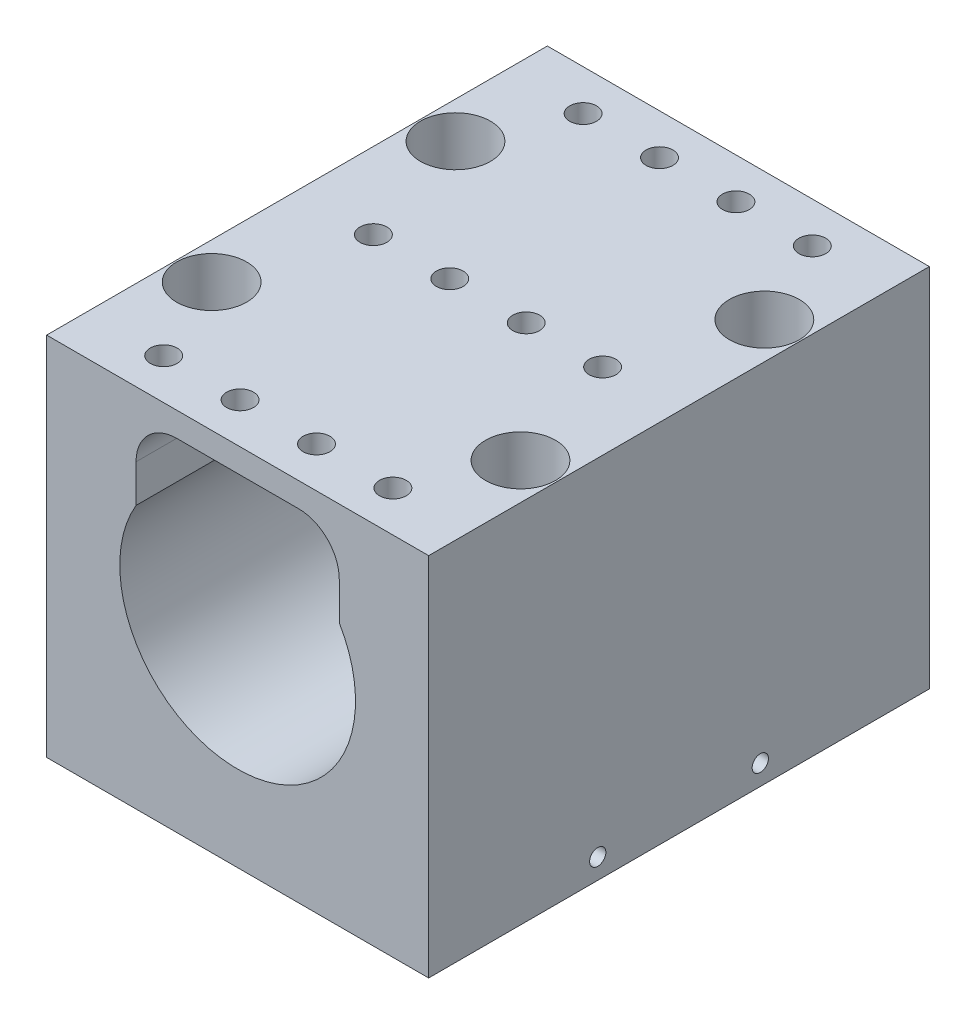
from build123d import *

# Parameters (mm, degrees)
SKETCH_1_W                       = 47
SKETCH_1_H                       = 45
EXTRUDE_1_DEPTH                  = 61.6
SKETCH_2_R                       = 14.5
CUT_EXTRUDE_1_DEPTH              = 100
SKETCH_6_R                       = 2.1
CUT_EXTRUDE_5_DEPTH              = 15
SKETCH_7_W                       = 25
SKETCH_7_H                       = 9.651530772
CUT_EXTRUDE_6_DEPTH              = 100
FILLET_1_R                       = 5
SKETCH_10_R                      = 2.75
CUT_EXTRUDE_8_DEPTH              = 100
PATTERN_LINEAR_2_COUNT           = 2
PATTERN_LINEAR_2_PITCH           = 38
PATTERN_LINEAR_2_COUNT_DIR2      = 2
PATTERN_LINEAR_2_PITCH_DIR2      = 30
SKETCH_11_R                      = 4.3
CUT_EXTRUDE_9_DEPTH              = 40
PATTERN_LINEAR_3_COUNT           = 2
PATTERN_LINEAR_3_PITCH           = 38
PATTERN_LINEAR_3_COUNT_DIR2      = 2
PATTERN_LINEAR_3_PITCH_DIR2      = 30
SKETCH_12_R                      = 1.65
CUT_EXTRUDE_10_DEPTH             = 5
PATTERN_LINEAR_4_COUNT           = 4
PATTERN_LINEAR_4_PITCH           = 9.4
PATTERN_LINEAR_5_COUNT           = 2
PATTERN_LINEAR_5_PITCH           = 25.8
PATTERN_LINEAR_5_COPY_1_SKETCH_R = 1.65
PATTERN_LINEAR_5_COPY_1_DEPTH    = 5
PATTERN_LINEAR_5_COPY_2_SKETCH_R = 1.65
PATTERN_LINEAR_5_COPY_2_DEPTH    = 5
PATTERN_LINEAR_5_COPY_3_SKETCH_R = 1.65
PATTERN_LINEAR_5_COPY_3_DEPTH    = 5
PATTERN_LINEAR_6_COUNT           = 2
PATTERN_LINEAR_6_PITCH           = 51.6
PATTERN_LINEAR_6_COPY_1_SKETCH_R = 1.65
PATTERN_LINEAR_6_COPY_1_DEPTH    = 5
PATTERN_LINEAR_6_COPY_2_SKETCH_R = 1.65
PATTERN_LINEAR_6_COPY_2_DEPTH    = 5
PATTERN_LINEAR_6_COPY_3_SKETCH_R = 1.65
PATTERN_LINEAR_6_COPY_3_DEPTH    = 5
SKETCH_13_R                      = 1
CUT_EXTRUDE_11_DEPTH             = 100


with BuildPart() as part:
    # Эскиз1 → Бобышка-Вытянуть1 (new body)
    with BuildSketch(Plane.XY):
        Rectangle(SKETCH_1_W, SKETCH_1_H)
    extrude(amount=EXTRUDE_1_DEPTH)

    # Эскиз2 → Вырез-Вытянуть1 (cut)
    with BuildSketch(Plane.XY.offset(61.6)):
        with Locations((0, 2.5)):
            Circle(SKETCH_2_R)
    extrude(amount=-CUT_EXTRUDE_1_DEPTH, mode=Mode.SUBTRACT)

    # Эскиз6 → Вырез-Вытянуть5 (cut)
    with BuildSketch(Plane(origin=(0, 0, 0), x_dir=(-1, 0, 0), z_dir=(0, 0, -1))):
        with Locations((-16.887495374, 12.25)):
            Circle(SKETCH_6_R)
        with Locations((-16.887495374, -7.25)):
            Circle(SKETCH_6_R)
        with Locations((16.887495374, 12.25)):
            Circle(SKETCH_6_R)
        with Locations((16.887495374, -7.25)):
            Circle(SKETCH_6_R)
    extrude(amount=-CUT_EXTRUDE_5_DEPTH, mode=Mode.SUBTRACT)

    # Эскиз7 → Вырез-Вытянуть6 (cut)
    with BuildSketch(Plane(origin=(0, 0, 0), x_dir=(-1, 0, 0), z_dir=(0, 0, -1))):
        with Locations((0, 14.674234614)):
            Rectangle(SKETCH_7_W, SKETCH_7_H)
    extrude(amount=-CUT_EXTRUDE_6_DEPTH, mode=Mode.SUBTRACT)

    # Скругление1
    fillet_1_edges = [part.edges().sort_by_distance(p)[0] for p in [
        (12.5, 19.5, 30.8),
        (-12.5, 19.5, 30.8),
    ]]
    fillet(fillet_1_edges, radius=FILLET_1_R)

    # Эскиз10 → Вырез-Вытянуть8 (cut)
    with BuildSketch(Plane(origin=(0, 22.5, 0), x_dir=(1, 0, 0), z_dir=(0, 1, 0))):
        with Locations(Location((-19, -15.8, 0), (0, 0, 270))):
            Circle(SKETCH_10_R)
    cut_extrude_8 = extrude(amount=-CUT_EXTRUDE_8_DEPTH, mode=Mode.SUBTRACT)

    # Линейный массив2: Cut-Extrude 8 2 × 2
    with Locations(*[(i * PATTERN_LINEAR_2_PITCH, 0, j * PATTERN_LINEAR_2_PITCH_DIR2) for i in range(PATTERN_LINEAR_2_COUNT) for j in range(PATTERN_LINEAR_2_COUNT_DIR2) if (i, j) != (0, 0)]):
        add(cut_extrude_8, mode=Mode.SUBTRACT)

    # Эскиз11 → Вырез-Вытянуть9 (cut)
    with BuildSketch(Plane(origin=(0, 22.5, 0), x_dir=(1, 0, 0), z_dir=(0, 1, 0))):
        with Locations(Location((-19, -15.8, 0), (0, 0, 270))):
            Circle(SKETCH_11_R)
    cut_extrude_9 = extrude(amount=-CUT_EXTRUDE_9_DEPTH, mode=Mode.SUBTRACT)

    # Линейный массив3: Cut-Extrude 9 2 × 2
    with Locations(*[(i * PATTERN_LINEAR_3_PITCH, 0, j * PATTERN_LINEAR_3_PITCH_DIR2) for i in range(PATTERN_LINEAR_3_COUNT) for j in range(PATTERN_LINEAR_3_COUNT_DIR2) if (i, j) != (0, 0)]):
        add(cut_extrude_9, mode=Mode.SUBTRACT)

    # Эскиз12 → Вырез-Вытянуть10 (cut)
    with BuildSketch(Plane(origin=(0, 22.5, 0), x_dir=(1, 0, 0), z_dir=(0, 1, 0))):
        with Locations(Location((-14.1, -5, 0), (0, 0, 270))):
            Circle(SKETCH_12_R)
    cut_extrude_10 = extrude(amount=-CUT_EXTRUDE_10_DEPTH, mode=Mode.SUBTRACT)

    # Линейный массив4: Вырез-Вытянуть10 ×4
    with Locations(*[(i * PATTERN_LINEAR_4_PITCH, 0, 0) for i in range(1, PATTERN_LINEAR_4_COUNT)]):
        add(cut_extrude_10, mode=Mode.SUBTRACT)

    # Линейный массив5: Вырез-Вытянуть10 ×2
    with Locations(*[(0, 0, i * PATTERN_LINEAR_5_PITCH) for i in range(1, PATTERN_LINEAR_5_COUNT)]):
        add(cut_extrude_10, mode=Mode.SUBTRACT)

    # Линейный массив5 copy 1 sketch → Линейный массив5 copy 1 (cut)
    with BuildSketch(Plane(origin=(9.4, 22.5, 25.8), x_dir=(1, 0, 0), z_dir=(0, 1, 0))):
        with Locations(Location((-14.1, -5, 0), (0, 0, 270))):
            Circle(PATTERN_LINEAR_5_COPY_1_SKETCH_R)
    extrude(amount=-PATTERN_LINEAR_5_COPY_1_DEPTH, mode=Mode.SUBTRACT)

    # Линейный массив5 copy 2 sketch → Линейный массив5 copy 2 (cut)
    with BuildSketch(Plane(origin=(18.8, 22.5, 25.8), x_dir=(1, 0, 0), z_dir=(0, 1, 0))):
        with Locations(Location((-14.1, -5, 0), (0, 0, 270))):
            Circle(PATTERN_LINEAR_5_COPY_2_SKETCH_R)
    extrude(amount=-PATTERN_LINEAR_5_COPY_2_DEPTH, mode=Mode.SUBTRACT)

    # Линейный массив5 copy 3 sketch → Линейный массив5 copy 3 (cut)
    with BuildSketch(Plane(origin=(28.2, 22.5, 25.8), x_dir=(1, 0, 0), z_dir=(0, 1, 0))):
        with Locations(Location((-14.1, -5, 0), (0, 0, 270))):
            Circle(PATTERN_LINEAR_5_COPY_3_SKETCH_R)
    extrude(amount=-PATTERN_LINEAR_5_COPY_3_DEPTH, mode=Mode.SUBTRACT)

    # Линейный массив6: Вырез-Вытянуть10 ×2
    with Locations(*[(0, 0, i * PATTERN_LINEAR_6_PITCH) for i in range(1, PATTERN_LINEAR_6_COUNT)]):
        add(cut_extrude_10, mode=Mode.SUBTRACT)

    # Линейный массив6 copy 1 sketch → Линейный массив6 copy 1 (cut)
    with BuildSketch(Plane(origin=(9.4, 22.5, 51.6), x_dir=(1, 0, 0), z_dir=(0, 1, 0))):
        with Locations(Location((-14.1, -5, 0), (0, 0, 270))):
            Circle(PATTERN_LINEAR_6_COPY_1_SKETCH_R)
    extrude(amount=-PATTERN_LINEAR_6_COPY_1_DEPTH, mode=Mode.SUBTRACT)

    # Линейный массив6 copy 2 sketch → Линейный массив6 copy 2 (cut)
    with BuildSketch(Plane(origin=(18.8, 22.5, 51.6), x_dir=(1, 0, 0), z_dir=(0, 1, 0))):
        with Locations(Location((-14.1, -5, 0), (0, 0, 270))):
            Circle(PATTERN_LINEAR_6_COPY_2_SKETCH_R)
    extrude(amount=-PATTERN_LINEAR_6_COPY_2_DEPTH, mode=Mode.SUBTRACT)

    # Линейный массив6 copy 3 sketch → Линейный массив6 copy 3 (cut)
    with BuildSketch(Plane(origin=(28.2, 22.5, 51.6), x_dir=(1, 0, 0), z_dir=(0, 1, 0))):
        with Locations(Location((-14.1, -5, 0), (0, 0, 270))):
            Circle(PATTERN_LINEAR_6_COPY_3_SKETCH_R)
    extrude(amount=-PATTERN_LINEAR_6_COPY_3_DEPTH, mode=Mode.SUBTRACT)

    # Эскиз13 → Вырез-Вытянуть11 (cut)
    with BuildSketch(Plane(origin=(23.5, 0, 0), x_dir=(0, 0, -1), z_dir=(1, 0, 0))):
        with Locations(Location((-40.8, -20, 0), (0, 0, 90))):
            Circle(SKETCH_13_R)
        with Locations(Location((-20.8, -20, 0), (0, 0, 90))):
            Circle(SKETCH_13_R)
    extrude(amount=-CUT_EXTRUDE_11_DEPTH, mode=Mode.SUBTRACT)


solid = part.part
